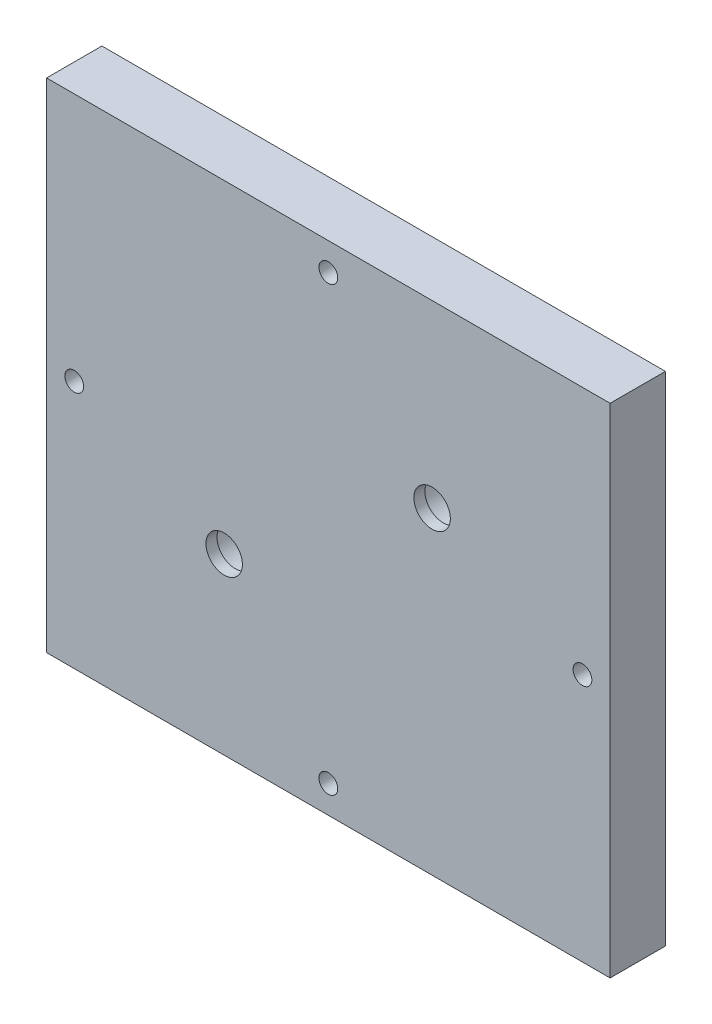
from build123d import *

# Parameters (mm, degrees)
ESBO_O1_W                = 101.9
ESBO_O1_H                = 90
RESSALTO_EXTRUS_O1_DEPTH = 10
FURO_COM_FOLGA_DE_M39_D  = 3.4
ESBO_O11_R               = 5
CORTE_EXTRUS_O1_DEPTH    = 8
FURO_COM_FOLGA_DE_M61_D  = 6.6


with BuildPart() as part:
    # Esboço1 → Ressalto-extrusão1 (new body)
    with BuildSketch(Plane.XY.offset(-23.335035958)):
        with Locations((-4.986758439, 13.850631826)):
            Rectangle(ESBO_O1_W, ESBO_O1_H)
    extrude(amount=RESSALTO_EXTRUS_O1_DEPTH)

    # Furo com folga de M39 (through all)
    with Locations(Plane(origin=(0, 0, -23.335035958), x_dir=(-1, 0, 0), z_dir=(0, 0, -1))):
        with Locations((-40.963241561, 13.850631826), (4.986758439, 53.850631826), (50.936758439, 13.850631826), (4.986758439, -26.149368174)):
            Hole(FURO_COM_FOLGA_DE_M39_D / 2)

    # Esboço11 → Corte-extrusão1 (cut)
    with BuildSketch(Plane(origin=(0, 0, -23.335035958), x_dir=(-1, 0, 0), z_dir=(0, 0, -1))):
        with Locations((-13.773241561, 26.330631826)):
            Circle(ESBO_O11_R)
        with Locations((23.826758439, 0.350631826)):
            Circle(ESBO_O11_R)
    extrude(amount=-CORTE_EXTRUS_O1_DEPTH, mode=Mode.SUBTRACT)

    # Furo com folga de M61 (through all)
    with Locations(Plane(origin=(0, 0, -15.335035958), x_dir=(-1, 0, 0), z_dir=(0, 0, -1))):
        with Locations((-13.773241561, 26.330631826), (23.826758439, 0.350631826)):
            Hole(FURO_COM_FOLGA_DE_M61_D / 2)


solid = part.part
